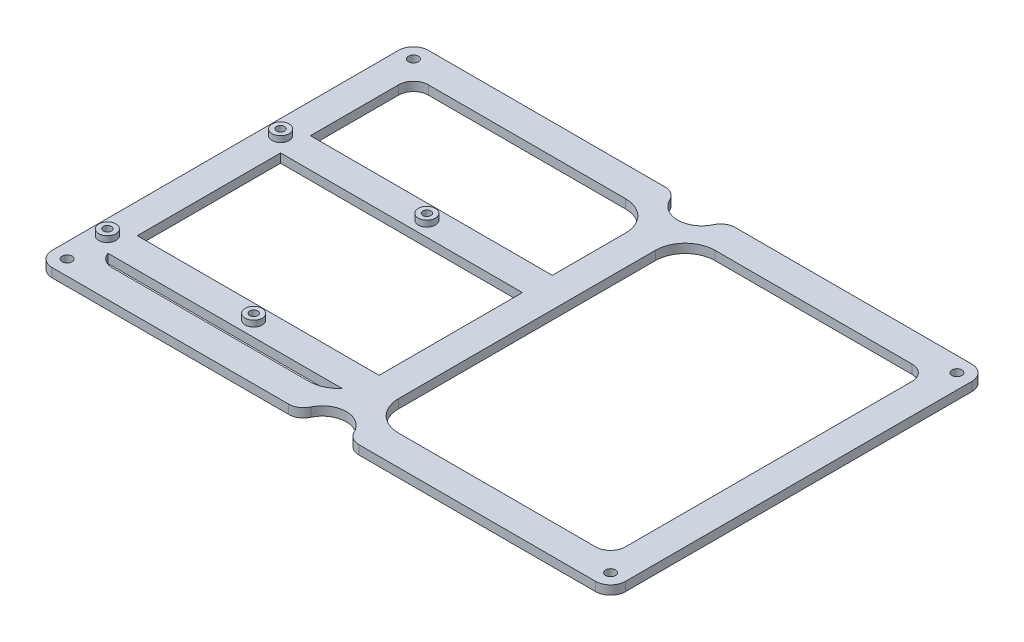
from build123d import *

# Parameters (mm, degrees)
SKETCH1_R           = 1.65
BOSS_EXTRUDE1_DEPTH = 3
BOSS_EXTRUDE2_START = -3
BOSS_EXTRUDE2_DEPTH = 3
SKETCH3_R           = 1.35
CUT_EXTRUDE1_DEPTH  = 3
BOSS_EXTRUDE3_START = 2
SKETCH4_R           = 2.85
SKETCH4_R_2         = 1.35
BOSS_EXTRUDE3_DEPTH = 2


with BuildPart() as part:
    # Sketch1 → Boss-Extrude1 (new body)
    with BuildSketch(Plane(origin=(0, 0, 0), x_dir=(1, 0, 0), z_dir=(0, 1, 0))):
        with BuildLine():
            Line((-91, 63), (-11.779218989, 63))
            ThreePointArc((-11.779218989, 63), (-9.093788212, 62.217636961), (-7.248750147, 60.115384615))
            ThreePointArc((-7.248750147, 60.115384615), (0, 55.5), (7.248750147, 60.115384615))
            ThreePointArc((7.248750147, 60.115384615), (9.093788212, 62.217636961), (11.779218989, 63))
            Line((11.779218989, 63), (91, 63))
            ThreePointArc((91, 63), (94.535533906, 61.535533906), (96, 58))
            Line((96, 58), (96, -58))
            ThreePointArc((96, -58), (94.535533906, -61.535533906), (91, -63))
            Line((91, -63), (11.779218989, -63))
            ThreePointArc((11.779218989, -63), (9.093788212, -62.217636961), (7.248750147, -60.115384615))
            ThreePointArc((7.248750147, -60.115384615), (0, -55.5), (-7.248750147, -60.115384615))
            ThreePointArc((-7.248750147, -60.115384615), (-9.093788212, -62.217636961), (-11.779218989, -63))
            Line((-11.779218989, -63), (-91, -63))
            ThreePointArc((-91, -63), (-94.535533906, -61.535533906), (-96, -58))
            Line((-96, -58), (-96, 58))
            ThreePointArc((-96, 58), (-94.535533906, 61.535533906), (-91, 63))
        make_face()
        with Locations(Location((-91, 58, 0), (0, 0, 270))):
            Circle(SKETCH1_R, mode=Mode.SUBTRACT)
        with Locations(Location((91, 58, 0), (0, 0, 270))):
            Circle(SKETCH1_R, mode=Mode.SUBTRACT)
        with Locations(Location((91, -58, 0), (0, 0, 270))):
            Circle(SKETCH1_R, mode=Mode.SUBTRACT)
        with Locations(Location((-91, -58, 0), (0, 0, 270))):
            Circle(SKETCH1_R, mode=Mode.SUBTRACT)
        with BuildLine():
            Line((-81, 53), (-15, 53))
            ThreePointArc((-15, 53), (-7.928932188, 50.071067812), (-5, 43))
            Line((-5, 43), (-5, -43))
            ThreePointArc((-5, -43), (-7.928932188, -50.071067812), (-15, -53))
            Line((-15, -53), (-81, -53))
            ThreePointArc((-81, -53), (-84.535533906, -51.535533906), (-86, -48))
            Line((-86, -48), (-86, 48))
            ThreePointArc((-86, 48), (-84.535533906, 51.535533906), (-81, 53))
        make_face(mode=Mode.SUBTRACT)
        with BuildLine():
            Line((86, -48), (86, 48))
            ThreePointArc((86, 48), (84.535533906, 51.535533906), (81, 53))
            Line((81, 53), (15, 53))
            ThreePointArc((15, 53), (7.928932188, 50.071067812), (5, 43))
            Line((5, 43), (5, -43))
            ThreePointArc((5, -43), (7.928932188, -50.071067812), (15, -53))
            Line((15, -53), (81, -53))
            ThreePointArc((81, -53), (84.535533906, -51.535533906), (86, -48))
        make_face(mode=Mode.SUBTRACT)
    extrude(amount=BOSS_EXTRUDE1_DEPTH)

    # Sketch2 → Boss-Extrude2 (add)
    with BuildSketch(Plane(origin=(0, 3, 0), x_dir=(1, 0, 0), z_dir=(0, 1, 0)).offset(BOSS_EXTRUDE2_START)):
        with BuildLine():
            Line((-42, -39.5), (-86, -39.5))
            Line((-86, -39.5), (-86, -48))
            ThreePointArc((-86, -48), (-85.942088629, -48.758788496), (-85.769696007, -49.5))
            Line((-85.769696007, -49.5), (-42, -49.5))
            Line((-42, -49.5), (-7.400657923, -49.5))
            ThreePointArc((-7.400657923, -49.5), (-5.619343819, -46.464576398), (-5, -43))
            Line((-5, -43), (-5, -39.5))
            Line((-5, -39.5), (-42, -39.5))
        make_face()
        Polygon((-86, 18.5), (-86, 8.5), (-42, 8.5), (-5, 8.5), (-5, 18.5), (-42, 18.5), align=None)
    extrude(amount=BOSS_EXTRUDE2_DEPTH)

    # Sketch3 → Cut-Extrude1 (cut)
    with BuildSketch(Plane(origin=(0, 3, 0), x_dir=(1, 0, 0), z_dir=(0, 1, 0))):
        with Locations(Location((-42, -44.5, 0), (0, 0, 270))):
            Circle(SKETCH3_R)
        with Locations(Location((-91, -44.5, 0), (0, 0, 270))):
            Circle(SKETCH3_R)
        with Locations(Location((-42, 13.5, 0), (0, 0, 270))):
            Circle(SKETCH3_R)
        with Locations(Location((-91, 13.5, 0), (0, 0, 270))):
            Circle(SKETCH3_R)
    extrude(amount=-CUT_EXTRUDE1_DEPTH, mode=Mode.SUBTRACT)

    # Sketch4 → Boss-Extrude3 (add)
    # profile 1 of 4: a face of its own
    with BuildSketch(Plane(origin=(0, 3, 0), x_dir=(1, 0, 0), z_dir=(0, 1, 0)).offset(BOSS_EXTRUDE3_START)):
        with Locations(Location((-91, 13.5, 0), (0, 0, 90))):
            Circle(SKETCH4_R)
        with Locations(Location((-91, 13.5, 0), (0, 0, 270))):
            Circle(SKETCH4_R_2, mode=Mode.SUBTRACT)
    # profile 2 of 4: a face of its own
    with BuildSketch(Plane(origin=(0, 3, 0), x_dir=(1, 0, 0), z_dir=(0, 1, 0)).offset(BOSS_EXTRUDE3_START)):
        with Locations(Location((-91, -44.5, 0), (0, 0, 90))):
            Circle(SKETCH4_R)
        with Locations(Location((-91, -44.5, 0), (0, 0, 270))):
            Circle(SKETCH4_R_2, mode=Mode.SUBTRACT)
    # profile 3 of 4: a face of its own
    with BuildSketch(Plane(origin=(0, 3, 0), x_dir=(1, 0, 0), z_dir=(0, 1, 0)).offset(BOSS_EXTRUDE3_START)):
        with Locations(Location((-42, -44.5, 0), (0, 0, 90))):
            Circle(SKETCH4_R)
        with Locations(Location((-42, -44.5, 0), (0, 0, 270))):
            Circle(SKETCH4_R_2, mode=Mode.SUBTRACT)
    # profile 4 of 4: a face of its own
    with BuildSketch(Plane(origin=(0, 3, 0), x_dir=(1, 0, 0), z_dir=(0, 1, 0)).offset(BOSS_EXTRUDE3_START)):
        with Locations(Location((-42, 13.5, 0), (0, 0, 90))):
            Circle(SKETCH4_R)
        with Locations(Location((-42, 13.5, 0), (0, 0, 270))):
            Circle(SKETCH4_R_2, mode=Mode.SUBTRACT)
    extrude(amount=-BOSS_EXTRUDE3_DEPTH)


solid = part.part
